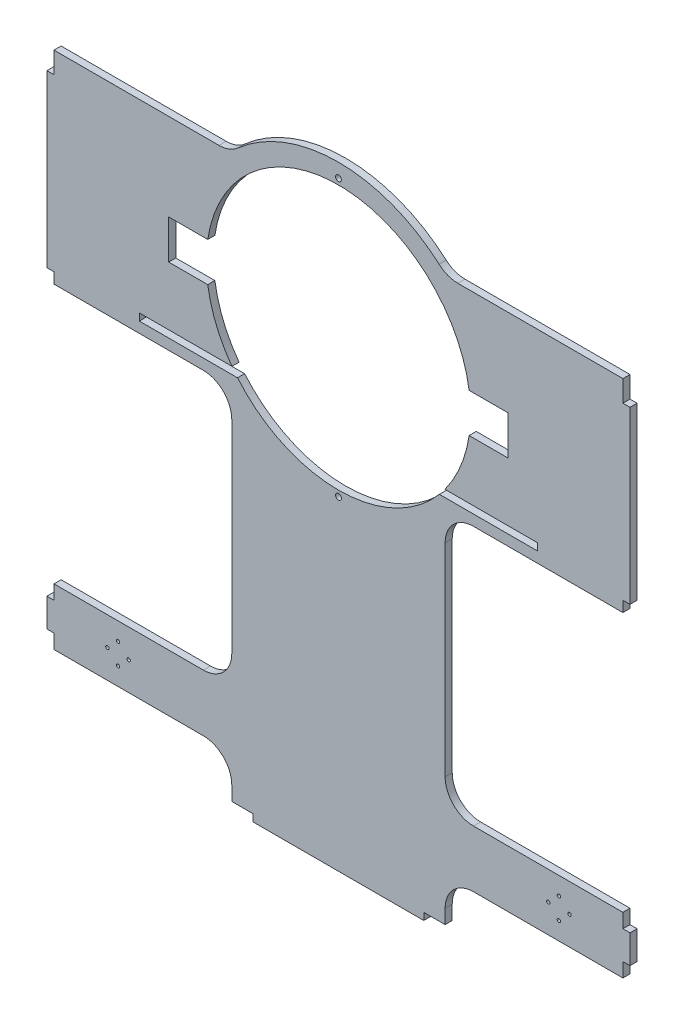
from build123d import *

# Parameters (mm, degrees)
MAIN_BODY_SKETCH_R     = 117.99951
MAIN_BODY_DEPTH        = 3.175
TABS_SKETCH_W          = 6.35
TABS_SKETCH_H          = 152.4
TABS_SKETCH_W_2        = 152.4
TABS_SKETCH_H_2        = 6.35
OUTSIDE_TABS_DEPTH     = 6.35
F_6_0_204_TUBE_MOUNT_D = 5.1816
SKETCH12_W             = 165.1
SKETCH12_H             = 50.8
BOSS_EXTRUDE1_DEPTH    = 6.35
SKETCH13_R             = 1.5
CUT_EXTRUDE1_DEPTH     = 489.042014073
SKETCH14_W             = 6.35
SKETCH14_H             = 12.7
CUT_EXTRUDE2_DEPTH     = 489.042014073
SKETCH15_W             = 87.70313901
SKETCH15_H             = 6.35
CUT_EXTRUDE3_DEPTH     = 489.042014073
SKETCH16_W             = 34.925
SKETCH16_H             = 34.925
CUT_EXTRUDE4_DEPTH     = 489.042014073
SKETCH17_W             = 158.75
SKETCH17_H             = 10.820932089
CUT_EXTRUDE5_DEPTH     = 489.042014073
FILLET1_R              = 25.4


with BuildPart() as part:
    # Main Body Sketch → Main Body (new, symmetric)
    with BuildSketch(Plane.XY):
        with BuildLine():
            Line((-96.545932089, -95.25), (-254, -95.25))
            Line((-254, -95.25), (-254, 95.25))
            Line((-254, 95.25), (-96.545932089, 95.25))
            ThreePointArc((-96.545932089, 95.25), (0, 135.6233), (96.545932089, 95.25))
            Line((96.545932089, 95.25), (254, 95.25))
            Line((254, 95.25), (254, -95.25))
            Line((254, -95.25), (96.545932089, -95.25))
            ThreePointArc((96.545932089, -95.25), (95.900155117, -95.900155117), (95.25, -96.545932089))
            Line((95.25, -96.545932089), (95.25, -406.4))
            Line((95.25, -406.4), (-95.25, -406.4))
            Line((-95.25, -406.4), (-95.25, -96.545932089))
            ThreePointArc((-95.25, -96.545932089), (-95.900155117, -95.900155117), (-96.545932089, -95.25))
        make_face()
        Circle(MAIN_BODY_SKETCH_R, mode=Mode.SUBTRACT)
    extrude(amount=MAIN_BODY_DEPTH, both=True)

    # Tabs Sketch → Outside Tabs (add)
    with BuildSketch(Plane.XY.offset(3.175)):
        with Locations((-257.175, 0)):
            Rectangle(TABS_SKETCH_W, TABS_SKETCH_H)
        with Locations((0, -409.575)):
            Rectangle(TABS_SKETCH_W_2, TABS_SKETCH_H_2)
    outside_tabs = extrude(amount=-OUTSIDE_TABS_DEPTH)

    # Outside Tabs Mirror: Outside Tabs across plane
    add(outside_tabs.mirror(Plane(origin=(0, 0, 0), x_dir=(0, 0, 1), z_dir=(1, 0, 0))))

    # #6 (0.204) Tube Mount (through all)
    with Locations(Plane.XY.offset(3.175)):
        with Locations((0, -123.19), (123.19, 0), (0, 123.19), (-123.19, 0)):
            Hole(F_6_0_204_TUBE_MOUNT_D / 2)

    # Sketch12 → Boss-Extrude1 (add)
    with BuildSketch(Plane.XY.offset(3.175)):
        with Locations((-177.8, -342.9)):
            Rectangle(SKETCH12_W, SKETCH12_H)
        with Locations((177.8, -342.9)):
            Rectangle(SKETCH12_W, SKETCH12_H)
    extrude(amount=-BOSS_EXTRUDE1_DEPTH)

    # Sketch13 → Cut-Extrude1 (cut, through all)
    with BuildSketch(Plane.XY.offset(3.175)):
        with Locations((-196.85, -333.4)):
            Circle(SKETCH13_R)
        with Locations((-187.35, -342.9)):
            Circle(SKETCH13_R)
        with Locations((-196.85, -352.4)):
            Circle(SKETCH13_R)
        with Locations((-206.35, -342.9)):
            Circle(SKETCH13_R)
    cut_extrude1 = extrude(amount=-CUT_EXTRUDE1_DEPTH, mode=Mode.SUBTRACT)

    # Mirror2: Cut-Extrude1 across plane
    add(cut_extrude1.mirror(Plane(origin=(0, 0, 0), x_dir=(0, 0, 1), z_dir=(1, 0, 0))), mode=Mode.SUBTRACT)

    # Sketch14 → Cut-Extrude2 (cut, through all)
    with BuildSketch(Plane.XY.offset(3.175)):
        with Locations((-257.175, -323.85)):
            Rectangle(SKETCH14_W, SKETCH14_H)
        with Locations((-257.175, -361.95)):
            Rectangle(SKETCH14_W, SKETCH14_H)
    cut_extrude2 = extrude(amount=-CUT_EXTRUDE2_DEPTH, mode=Mode.SUBTRACT)

    # Mirror3: Cut-Extrude2 across plane
    add(cut_extrude2.mirror(Plane(origin=(0, 0, 0), x_dir=(0, 0, 1), z_dir=(1, 0, 0))), mode=Mode.SUBTRACT)

    # Sketch15 → Cut-Extrude3 (cut, through all)
    with BuildSketch(Plane.XY.offset(3.175)):
        with Locations((-133.948430495, -73.025)):
            Rectangle(SKETCH15_W, SKETCH15_H)
        with Locations((133.948430495, -73.025)):
            Rectangle(SKETCH15_W, SKETCH15_H)
    extrude(amount=-CUT_EXTRUDE3_DEPTH, mode=Mode.SUBTRACT)

    # Sketch16 → Cut-Extrude4 (cut, through all)
    with BuildSketch(Plane.XY.offset(3.175)):
        with Locations((134.162737592, 0)):
            Rectangle(SKETCH16_W, SKETCH16_H)
    cut_extrude4 = extrude(amount=-CUT_EXTRUDE4_DEPTH, mode=Mode.SUBTRACT)

    # Mirror4: Cut-Extrude4 across plane
    add(cut_extrude4.mirror(Plane(origin=(0, 0, 0), x_dir=(0, 0, 1), z_dir=(1, 0, 0))), mode=Mode.SUBTRACT)

    # Sketch17 → Cut-Extrude5 (cut, through all)
    with BuildSketch(Plane.XY.offset(3.175)):
        with Locations((-174.625, -91.135466045)):
            Rectangle(SKETCH17_W, SKETCH17_H)
    cut_extrude5 = extrude(amount=-CUT_EXTRUDE5_DEPTH, mode=Mode.SUBTRACT)

    # Mirror5: Cut-Extrude5 across plane
    add(cut_extrude5.mirror(Plane(origin=(0, 0, 0), x_dir=(0, 0, 1), z_dir=(1, 0, 0))), mode=Mode.SUBTRACT)

    # Fillet1
    fillet1_edges = [part.edges().sort_by_distance(p)[0] for p in [
        (-95.25, -317.5, 0),
        (-95.25, -368.3, 0),
        (95.25, -317.5, 0),
        (95.25, -368.3, 0),
        (-96.545932089, 95.25, 0),
        (96.545932089, 95.25, 0),
        (-95.25, -85.725, 0),
        (95.25, -85.725, 0),
    ]]
    fillet(fillet1_edges, radius=FILLET1_R)


solid = part.part
